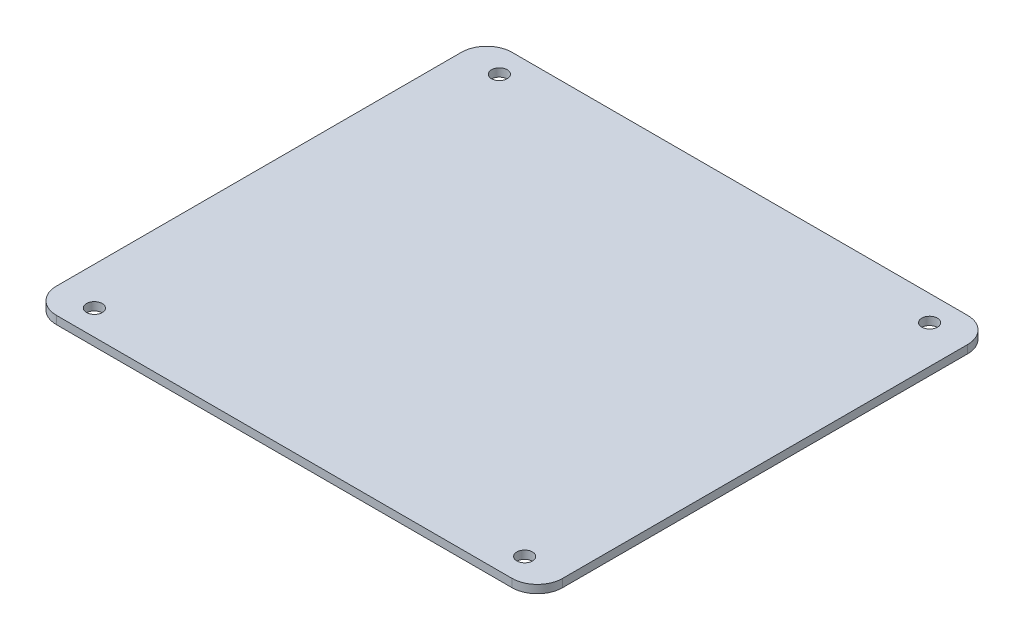
from build123d import *

# Parameters (mm, degrees)
SKETCH_1_W      = 100
SKETCH_1_H      = 90
SKETCH_1_R      = 1.55
EXTRUDE_1_DEPTH = 1.6
FILLET_1_R      = 5


with BuildPart() as part:
    # 草图1 → 凸台-拉伸1 (new body)
    with BuildSketch(Plane(origin=(0, 0, 0), x_dir=(1, 0, 0), z_dir=(0, 1, 0))):
        Rectangle(SKETCH_1_W, SKETCH_1_H)
        with Locations(Location((-42.5, 40, 0), (0, 0, 270))):
            Circle(SKETCH_1_R, mode=Mode.SUBTRACT)
        with Locations(Location((42.5, 40, 0), (0, 0, 270))):
            Circle(SKETCH_1_R, mode=Mode.SUBTRACT)
        with Locations(Location((-42.5, -40, 0), (0, 0, 270))):
            Circle(SKETCH_1_R, mode=Mode.SUBTRACT)
        with Locations(Location((42.5, -40, 0), (0, 0, 270))):
            Circle(SKETCH_1_R, mode=Mode.SUBTRACT)
    extrude(amount=EXTRUDE_1_DEPTH)

    # 圆角1
    fillet_1_edges = [part.edges().sort_by_distance(p)[0] for p in [
        (-50, 0.8, -45),
        (50, 0.8, -45),
        (50, 0.8, 45),
        (-50, 0.8, 45),
    ]]
    fillet(fillet_1_edges, radius=FILLET_1_R)


solid = part.part
